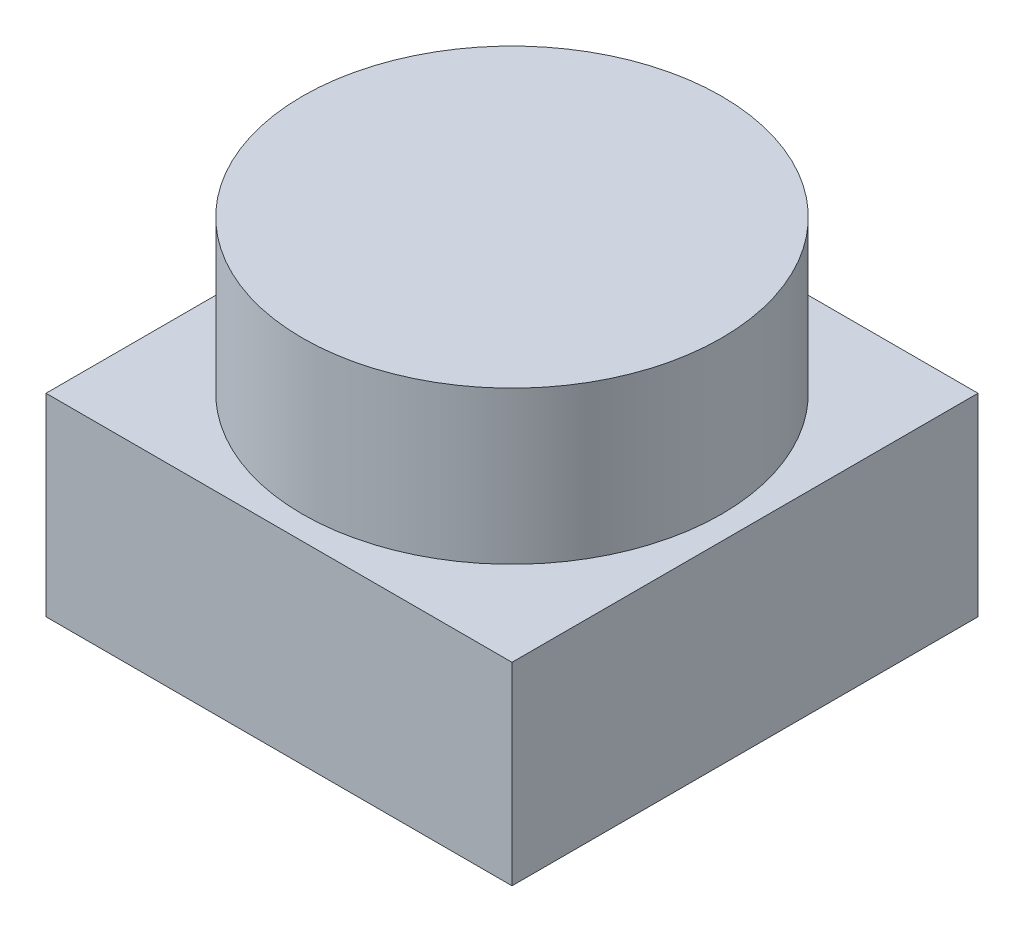
from build123d import *

# Parameters (mm, degrees)
SKETCH1_W           = 55.6
SKETCH1_H           = 55.6
BOSS_EXTRUDE1_DEPTH = 23.1
SKETCH2_R           = 25
BOSS_EXTRUDE2_DEPTH = 18.2
SKETCH3_R           = 1.5
CUT_EXTRUDE1_DEPTH  = 7


with BuildPart() as part:
    # Sketch1 → Boss-Extrude1 (new body)
    with BuildSketch(Plane(origin=(0, 0, 0), x_dir=(1, 0, 0), z_dir=(0, 1, 0))):
        Rectangle(SKETCH1_W, SKETCH1_H)
    extrude(amount=BOSS_EXTRUDE1_DEPTH)

    # Sketch2 → Boss-Extrude2 (add)
    with BuildSketch(Plane(origin=(0, 23.1, 0), x_dir=(1, 0, 0), z_dir=(0, 1, 0))):
        with Locations(Location((0, 0, 0), (0, 0, 270))):
            Circle(SKETCH2_R)
    extrude(amount=BOSS_EXTRUDE2_DEPTH)

    # Sketch3 → Cut-Extrude1 (cut)
    with BuildSketch(Plane.XZ):
        with Locations(Location((-21.5, 21.5, 0), (0, 0, 270))):
            Circle(SKETCH3_R)
        with Locations(Location((21.5, 21.5, 0), (0, 0, 270))):
            Circle(SKETCH3_R)
        with Locations(Location((-21.5, -21.5, 0), (0, 0, 270))):
            Circle(SKETCH3_R)
        with Locations(Location((21.5, -21.5, 0), (0, 0, 270))):
            Circle(SKETCH3_R)
    extrude(amount=-CUT_EXTRUDE1_DEPTH, mode=Mode.SUBTRACT)


solid = part.part
